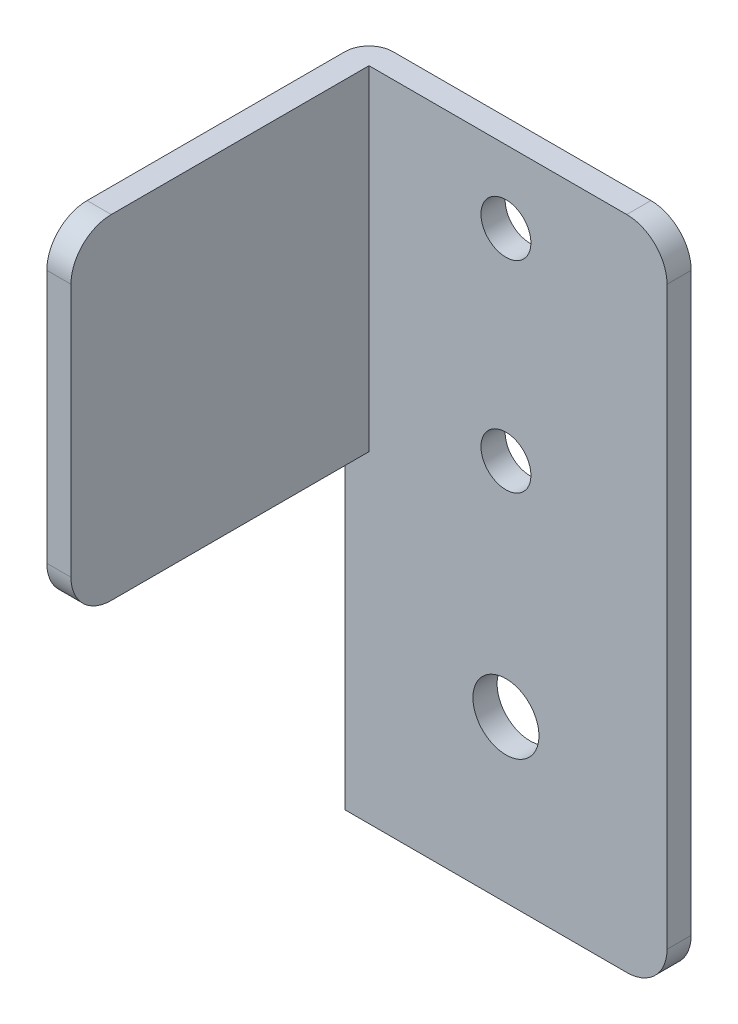
from build123d import *

# Parameters (mm, degrees)
EXTRUDE_THIN1_DEPTH = 81.5
SKETCH2_W           = 37
SKETCH2_H           = 40
CUT_EXTRUDE1_DEPTH  = 10
SKETCH3_R           = 4.1
CUT_EXTRUDE2_DEPTH  = 10
SKETCH4_R           = 3.1
CUT_EXTRUDE3_DEPTH  = 10
FILLET1_R           = 5


with BuildPart() as part:
    # Sketch1 → Extrude-Thin1 (new body)
    with BuildSketch(Plane(origin=(0, 0, 0), x_dir=(1, 0, 0), z_dir=(0, 1, 0))):
        with BuildLine():
            Line((40, 0), (3, 0))
            ThreePointArc((3, 0), (0.878679656, -0.878679656), (0, -3))
            Line((0, -3), (0, -40))
            Line((0, -40), (3, -40))
            Line((3, -40), (3, -3))
            Line((3, -3), (40, -3))
            Line((40, -3), (40, 0))
        make_face()
    extrude(amount=EXTRUDE_THIN1_DEPTH)

    # Sketch2 → Cut-Extrude1 (cut)
    with BuildSketch(Plane(origin=(3, 0, 0), x_dir=(0, 0, -1), z_dir=(1, 0, 0))):
        with Locations((-21.5, 20)):
            Rectangle(SKETCH2_W, SKETCH2_H)
    extrude(amount=-CUT_EXTRUDE1_DEPTH, mode=Mode.SUBTRACT)

    # Sketch3 → Cut-Extrude2 (cut)
    with BuildSketch(Plane(origin=(0, 0, 0), x_dir=(-1, 0, 0), z_dir=(0, 0, -1))):
        with Locations((-20, 20)):
            Circle(SKETCH3_R)
    extrude(amount=-CUT_EXTRUDE2_DEPTH, mode=Mode.SUBTRACT)

    # Sketch4 → Cut-Extrude3 (cut)
    with BuildSketch(Plane(origin=(0, 0, 0), x_dir=(-1, 0, 0), z_dir=(0, 0, -1))):
        with Locations((-20, 47.5)):
            Circle(SKETCH4_R)
        with Locations((-20, 72.5)):
            Circle(SKETCH4_R)
    extrude(amount=-CUT_EXTRUDE3_DEPTH, mode=Mode.SUBTRACT)

    # Fillet1
    fillet1_edges = [part.edges().sort_by_distance(p)[0] for p in [
        (1.5, 81.5, 40),
        (1.5, 40, 40),
        (40, 81.5, 1.5),
        (40, 0, 1.5),
    ]]
    fillet(fillet1_edges, radius=FILLET1_R)


solid = part.part
